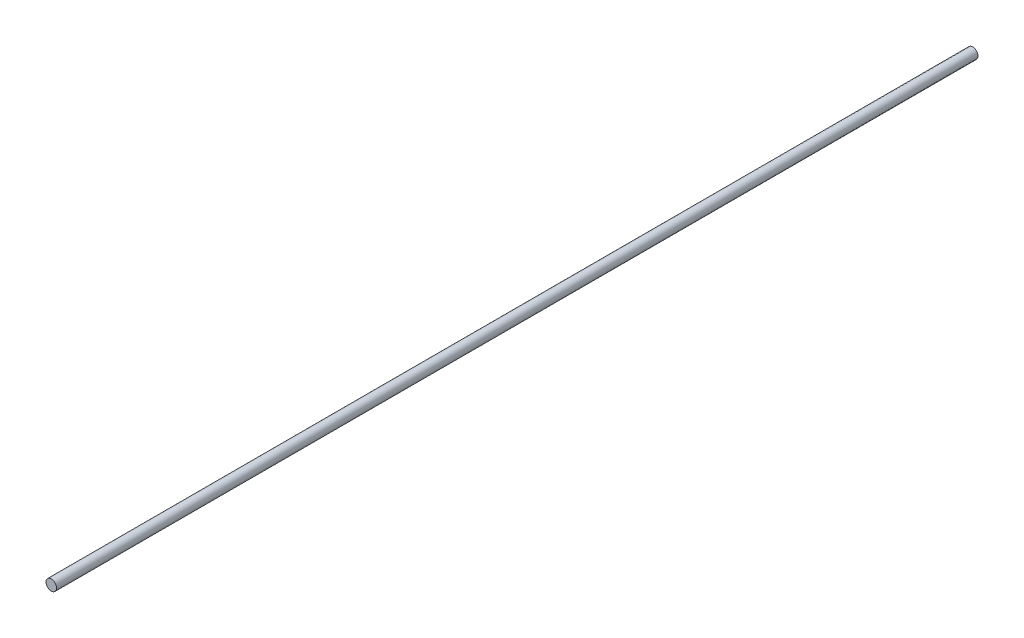
from build123d import *

# Parameters (mm, degrees)
SKETCH1_R           = 4
BOSS_EXTRUDE1_DEPTH = 700


with BuildPart() as part:
    # Sketch1 → Boss-Extrude1 (new body)
    with BuildSketch(Plane.XY):
        Circle(SKETCH1_R)
    extrude(amount=BOSS_EXTRUDE1_DEPTH)


solid = part.part
